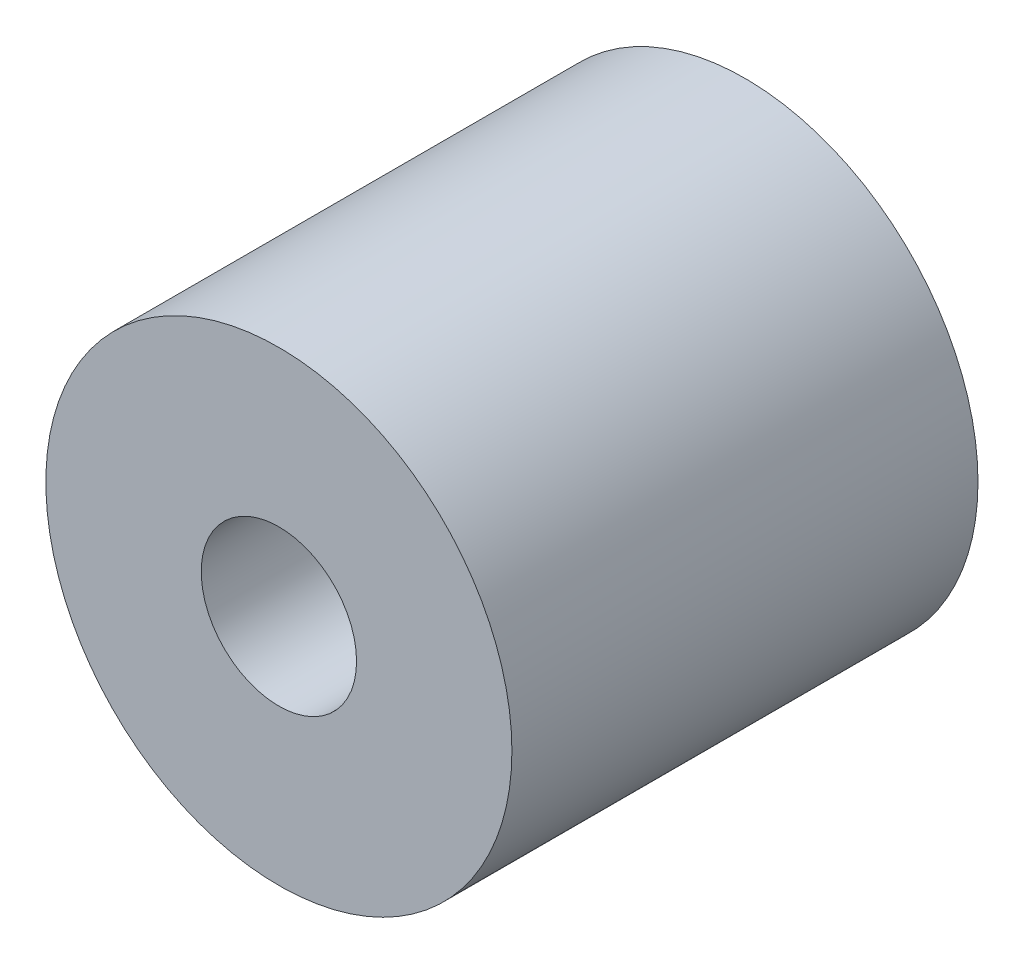
from build123d import *

# Parameters (mm, degrees)
SCHIZZO1_R                   = 7.5
ESTRUSIONE_ESTRUSIONE1_DEPTH = 15
SCHIZZO2_R                   = 2.5
TAGLIO_ESTRUSIONE1_DEPTH     = 19.371173071


with BuildPart() as part:
    # Schizzo1 → Estrusione-Estrusione1 (new body)
    with BuildSketch(Plane.XY):
        Circle(SCHIZZO1_R)
    extrude(amount=ESTRUSIONE_ESTRUSIONE1_DEPTH)

    # Schizzo2 → Taglio-Estrusione1 (cut, through all)
    with BuildSketch(Plane.XY.offset(15)):
        Circle(SCHIZZO2_R)
    extrude(amount=-TAGLIO_ESTRUSIONE1_DEPTH, mode=Mode.SUBTRACT)


solid = part.part
